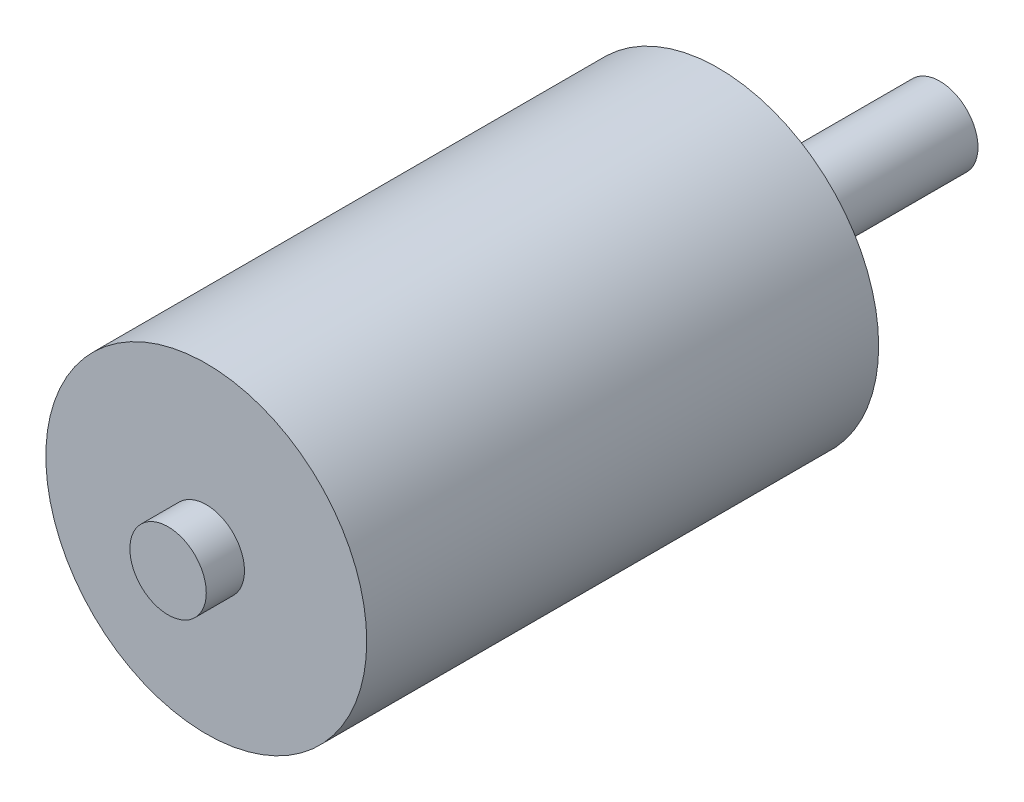
from build123d import *

# Parameters (mm, degrees)
SKETCH_1_R          = 21
EXTRUDE_1_DEPTH     = 67
SKETCH_3_R          = 13
EXTRUDE_3_DEPTH     = 2
SKETCH_4_R          = 5
EXTRUDE_4_DEPTH     = 29
SKETCH_5_R          = 2.016017639
SKETCH_5_R_2        = 2.040158569
SKETCH_5_R_3        = 1.937096917
SKETCH_5_R_4        = 2
SKETCH_5_R_5        = 4.5
EXTRUDE_5_DEPTH     = 0.7
EXTRUDE_START       = 5
SKETCH_7_R          = 5
EXTRUDE_6_DEPTH     = 5
SKETCH_6_R          = 2
CUT_EXTRUDE_1_DEPTH = 7


with BuildPart() as part:
    # 草图1 → 凸台-拉伸1 (new body)
    with BuildSketch(Plane.XY):
        Circle(SKETCH_1_R)
    extrude(amount=EXTRUDE_1_DEPTH)

    # 草图3 → 凸台-拉伸3 (add)
    with BuildSketch(Plane.XY):
        Circle(SKETCH_3_R)
    extrude(amount=-EXTRUDE_3_DEPTH)

    # 草图4 → 凸台-拉伸4 (add)
    with BuildSketch(Plane.XY):
        Circle(SKETCH_4_R)
    extrude(amount=-EXTRUDE_4_DEPTH)

    # 草图5 → 凸台-拉伸5 (add)
    with BuildSketch(Plane.XY):
        with Locations((17.5, 0)):
            Circle(SKETCH_5_R)
        with Locations((0, -17.5)):
            Circle(SKETCH_5_R_2)
        with Locations((-17.5, 0)):
            Circle(SKETCH_5_R_3)
        with Locations((0, 17.5)):
            Circle(SKETCH_5_R_4)
        with Locations((12.557158291, 12.188838159)):
            Circle(SKETCH_5_R_4)
        with Locations((-12.557158291, 12.188838159)):
            Circle(SKETCH_5_R_4)
        with Locations((-12.557158291, -12.188838159)):
            Circle(SKETCH_5_R_4)
        with Locations((12.557158291, -12.188838159)):
            Circle(SKETCH_5_R_4)
        Circle(SKETCH_5_R_5)
    extrude(amount=EXTRUDE_5_DEPTH)

    # 草图7 → 凸台-拉伸6 (add)
    with BuildSketch(Plane.XY.offset(67).offset(EXTRUDE_START)):
        Circle(SKETCH_7_R)
    extrude(amount=-EXTRUDE_6_DEPTH)

    # 草图6 → 切除-拉伸1 (cut)
    with BuildSketch(Plane.XY):
        with Locations((-17.5, 0)):
            Circle(SKETCH_6_R)
        with Locations((17.5, 0)):
            Circle(SKETCH_6_R)
        with Locations((0, 17.5)):
            Circle(SKETCH_6_R)
        with Locations((0, -17.5)):
            Circle(SKETCH_6_R)
    extrude(amount=CUT_EXTRUDE_1_DEPTH, mode=Mode.SUBTRACT)


solid = part.part
